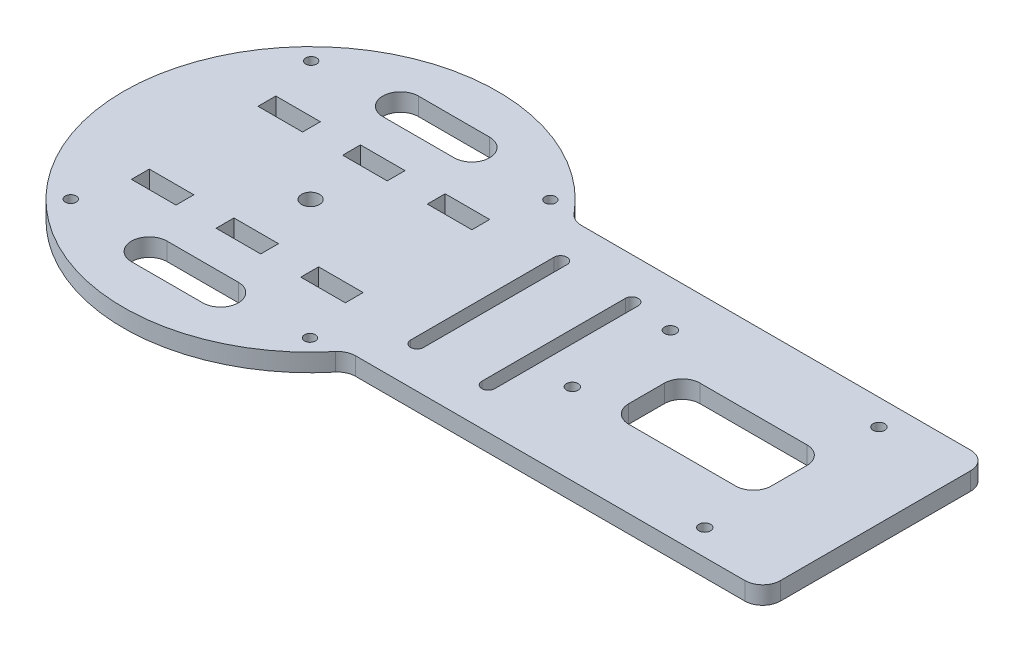
from build123d import *

# Parameters (mm, degrees)
SKETCH_1_R      = 1.525
SKETCH_1_R_2    = 2.5
SKETCH_1_R_3    = 1.625
SKETCH_1_W      = 12.5
SKETCH_1_H      = 5
SKETCH_1_W_2    = 40
SKETCH_1_H_2    = 20
EXTRUDE_1_DEPTH = 5
FILLET_1_R      = 5


with BuildPart() as part:
    # 草图1 → 凸台-拉伸1 (new body)
    with BuildSketch(Plane(origin=(0, 0, 0), x_dir=(1, 0, 0), z_dir=(0, 1, 0))):
        with BuildLine():
            Line((41.868178549, 31.675), (158.5, 31.675))
            Line((158.5, 31.675), (158.5, -31.675))
            Line((158.5, -31.675), (41.868178549, -31.675))
            ThreePointArc((41.868178549, -31.675), (-52.5, 0), (41.868178549, 31.675))
        make_face()
        with Locations(Location((-33.55358156, 33.720895004, 0), (0, 0, 270))):
            Circle(SKETCH_1_R, mode=Mode.SUBTRACT)
        with Locations(Location((0, 0, 0), (0, 0, 270))):
            Circle(SKETCH_1_R_2, mode=Mode.SUBTRACT)
        with Locations(Location((82.254, 18.675, 0), (0, 0, 270))):
            Circle(SKETCH_1_R_3, mode=Mode.SUBTRACT)
        with Locations(Location((82.254, -8.825, 0), (0, 0, 270))):
            Circle(SKETCH_1_R_3, mode=Mode.SUBTRACT)
        with Locations(Location((135, 24.425, 0), (0, 0, 270))):
            Circle(SKETCH_1_R_3, mode=Mode.SUBTRACT)
        with Locations(Location((135, -24.425, 0), (0, 0, 90))):
            Circle(SKETCH_1_R_3, mode=Mode.SUBTRACT)
        with Locations(Location((33.720895004, 33.55358156, 0), (0, 0, 270))):
            Circle(SKETCH_1_R, mode=Mode.SUBTRACT)
        with Locations(Location((33.55358156, -33.720895004, 0), (0, 0, 270))):
            Circle(SKETCH_1_R, mode=Mode.SUBTRACT)
        with Locations(Location((-33.720895004, -33.55358156, 0), (0, 0, 270))):
            Circle(SKETCH_1_R, mode=Mode.SUBTRACT)
        with Locations((23.75, -17.75)):
            Rectangle(SKETCH_1_W, SKETCH_1_H, mode=Mode.SUBTRACT)
        with Locations((-23.75, 17.75)):
            Rectangle(SKETCH_1_W, SKETCH_1_H, mode=Mode.SUBTRACT)
        with Locations((0, 17.75)):
            Rectangle(SKETCH_1_W, SKETCH_1_H, mode=Mode.SUBTRACT)
        with Locations((23.75, 17.75)):
            Rectangle(SKETCH_1_W, SKETCH_1_H, mode=Mode.SUBTRACT)
        with Locations((0, -17.75)):
            Rectangle(SKETCH_1_W, SKETCH_1_H, mode=Mode.SUBTRACT)
        with Locations((-23.75, -17.75)):
            Rectangle(SKETCH_1_W, SKETCH_1_H, mode=Mode.SUBTRACT)
        with BuildLine():
            Line((-10, -30.25), (10, -30.25))
            ThreePointArc((10, -30.25), (15, -35.25), (10, -40.25))
            Line((10, -40.25), (-10, -40.25))
            ThreePointArc((-10, -40.25), (-15, -35.25), (-10, -30.25))
        make_face(mode=Mode.SUBTRACT)
        with BuildLine():
            Line((-10, 40.25), (10, 40.25))
            ThreePointArc((10, 40.25), (15, 35.25), (10, 30.25))
            Line((10, 30.25), (-10, 30.25))
            ThreePointArc((-10, 30.25), (-15, 35.25), (-10, 40.25))
        make_face(mode=Mode.SUBTRACT)
        with BuildLine():
            Line((48.183761531, 20.125053296), (48.183761531, -20.125053296))
            ThreePointArc((48.183761531, -20.125053296), (50, -21.941291765), (51.816238469, -20.125053296))
            Line((51.816238469, -20.125053296), (51.816238469, 20.125053296))
            ThreePointArc((51.816238469, 20.125053296), (50, 21.941291765), (48.183761531, 20.125053296))
        make_face(mode=Mode.SUBTRACT)
        with BuildLine():
            Line((68.183761531, 20.125053296), (68.183761531, -20.125053296))
            ThreePointArc((68.183761531, -20.125053296), (70, -21.941291765), (71.816238469, -20.125053296))
            Line((71.816238469, -20.125053296), (71.816238469, 20.125053296))
            ThreePointArc((71.816238469, 20.125053296), (70, 21.941291765), (68.183761531, 20.125053296))
        make_face(mode=Mode.SUBTRACT)
        with Locations((114.25, 0)):
            Rectangle(SKETCH_1_W_2, SKETCH_1_H_2, mode=Mode.SUBTRACT)
    extrude(amount=EXTRUDE_1_DEPTH)

    # 圆角1
    fillet_1_edges = [part.edges().sort_by_distance(p)[0] for p in [
        (94.25, 2.5, -10),
        (94.25, 2.5, 10),
        (134.25, 2.5, 10),
        (134.25, 2.5, -10),
        (41.868178549, 2.5, -31.675),
        (158.5, 2.5, -31.675),
        (158.5, 2.5, 31.675),
        (41.868178549, 2.5, 31.675),
    ]]
    fillet(fillet_1_edges, radius=FILLET_1_R)


solid = part.part
